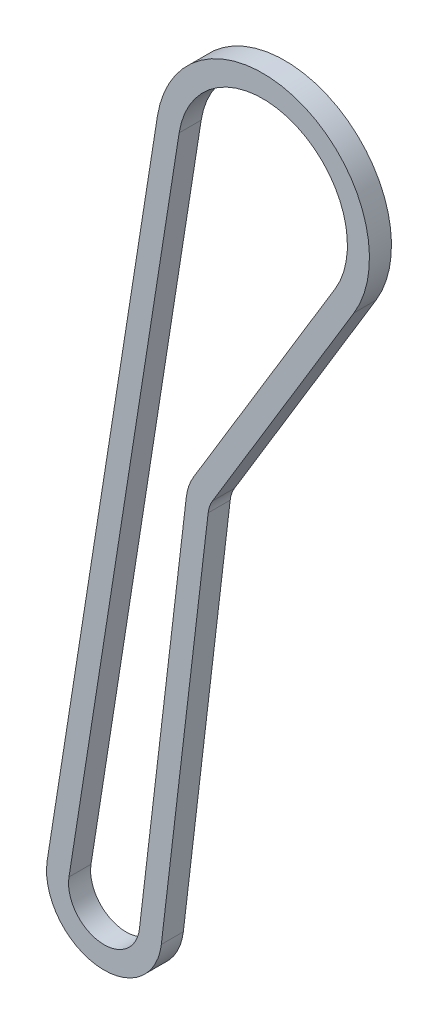
from build123d import *

# Parameters (mm, degrees)
EXTRUDE_THIN1_DEPTH = 5


with BuildPart() as part:
    # Sketch2 → Extrude-Thin1 (new body)
    with BuildSketch(Plane.XY):
        with BuildLine():
            Line((14.887131394, 82.636077838), (4.256350187, -7.49933382))
            ThreePointArc((4.256350187, -7.49933382), (-10.506003475, -18.916342962), (-21.634589327, -3.93536301))
            Line((-21.634589327, -3.93536301), (3.361011475, 154.797495405))
            ThreePointArc((3.361011475, 154.797495405), (35.58717678, 173.770376713), (47.983576242, 138.488295769))
            Line((47.983576242, 138.488295769), (15.851718131, 85.44288319))
            ThreePointArc((15.851718131, 85.44288319), (15.218957799, 84.091189991), (14.887131394, 82.636077838))
        make_face()
        with BuildLine():
            Line((9.921548726, 83.221730268), (-0.709232481, -6.91368139))
            ThreePointArc((-0.709232481, -6.91368139), (-9.824166991, -13.963051227), (-16.695451446, -4.71312711))
            Line((-16.695451446, -4.71312711), (8.300149356, 154.019731305))
            ThreePointArc((8.300149356, 154.019731305), (33.870766271, 169.074214987), (43.706984101, 141.078809165))
            Line((43.706984101, 141.078809165), (11.575125989, 88.033396586))
            ThreePointArc((11.575125989, 88.033396586), (10.490393993, 85.716208245), (9.921548726, 83.221730268))
        make_face(mode=Mode.SUBTRACT)
    extrude(amount=-EXTRUDE_THIN1_DEPTH)


solid = part.part
